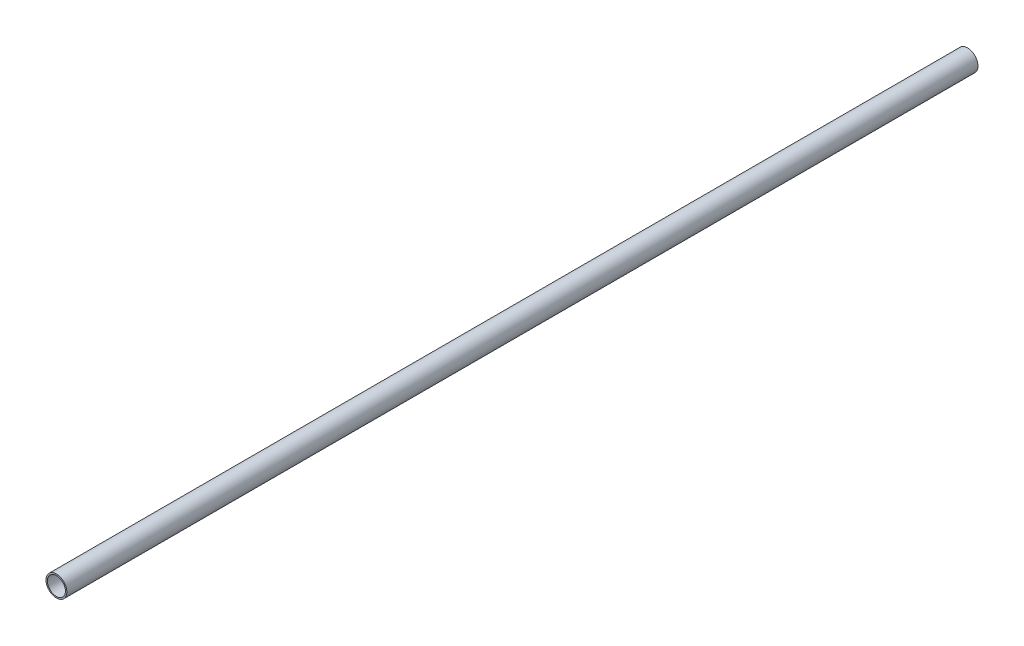
from build123d import *

# Parameters (mm, degrees)
SKETCH1_R           = 15
SKETCH1_R_2         = 13
BOSS_EXTRUDE1_DEPTH = 1310


with BuildPart() as part:
    # Sketch1 → Boss-Extrude1 (new body)
    with BuildSketch(Plane.XY):
        Circle(SKETCH1_R)
        Circle(SKETCH1_R_2, mode=Mode.SUBTRACT)
    extrude(amount=BOSS_EXTRUDE1_DEPTH)


solid = part.part
